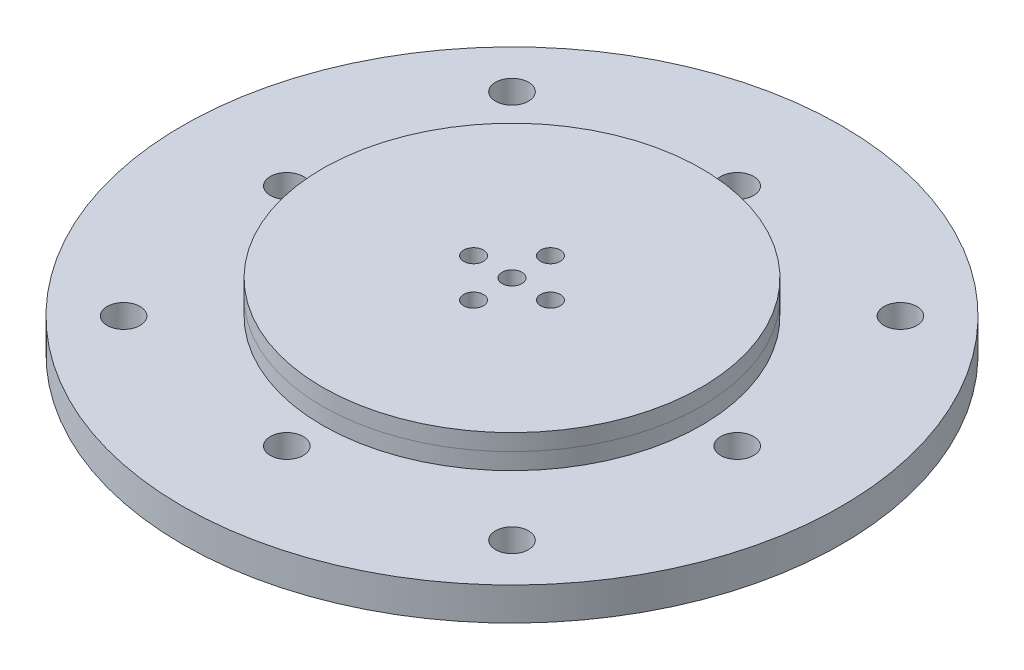
from build123d import *

# Parameters (mm, degrees)
SKETCH1_R                      = 60
BOSS_EXTRUDE1_DEPTH            = 6
SKETCH3_R                      = 34.5
BOSS_EXTRUDE3_DEPTH            = 3
F_6_0_6_DIAMETER_HOLE1_D       = 6
F_6_0_6_DIAMETER_HOLE2_D       = 6
CBORE_FOR_M3_SHCS1_D           = 3.6
CBORE_FOR_M3_SHCS1_CBORE_D     = 6.5
CBORE_FOR_M3_SHCS1_CBORE_DEPTH = 3
MOVE_FACE1_BY                  = 3


with BuildPart() as part:
    # Sketch1 → Boss-Extrude1 (new body)
    with BuildSketch(Plane(origin=(0, 0, 0), x_dir=(1, 0, 0), z_dir=(0, 1, 0))):
        Circle(SKETCH1_R)
    extrude(amount=-BOSS_EXTRUDE1_DEPTH)

    # Sketch3 → Boss-Extrude3 (add)
    with BuildSketch(Plane(origin=(0, 0, 0), x_dir=(1, 0, 0), z_dir=(0, 1, 0))):
        Circle(SKETCH3_R)
    extrude(amount=BOSS_EXTRUDE3_DEPTH)

    # Ø6.0 (6) Diameter Hole1 (through all)
    with Locations(Plane(origin=(0, -6, 0), x_dir=(-1, 0, 0), z_dir=(0, -1, 0))):
        with Locations((0, 41), (0, -41), (41, 0), (-41, 0)):
            Hole(F_6_0_6_DIAMETER_HOLE1_D / 2)

    # Ø6.0 (6) Diameter Hole2 (through all)
    with Locations(Plane(origin=(0, -6, 0), x_dir=(-1, 0, 0), z_dir=(0, -1, 0))):
        with Locations((-35.355339059, 35.355339059), (35.355339059, -35.355339059), (-35.355339059, -35.355339059), (35.355339059, 35.355339059)):
            Hole(F_6_0_6_DIAMETER_HOLE2_D / 2)

    # CBORE for M3 SHCS1 (through all)
    with Locations(Plane(origin=(0, -6, 0), x_dir=(-1, 0, 0), z_dir=(0, -1, 0))):
        with Locations((0, 0), (0, 7), (0, -7), (-7, 0), (7, 0)):
            CounterBoreHole(CBORE_FOR_M3_SHCS1_D / 2, CBORE_FOR_M3_SHCS1_CBORE_D / 2, CBORE_FOR_M3_SHCS1_CBORE_DEPTH)

    # Move Face1: a face moved outward by 3.0
    extrude(part.faces().sort_by_distance((0, 3, 17.25))[0], amount=MOVE_FACE1_BY, dir=(0, 1, 0))


with BuildPart() as body_2:
    # Split1: the piece on the far side of the plane
    add(part.part)
    split(bisect_by=Plane.ZX.offset(3), keep=Keep.BOTTOM)


with BuildPart() as part_1:
    add(part.part)

    # Split1
    split(bisect_by=Plane.ZX.offset(3), keep=Keep.TOP)


solid = Compound([body_2.part, part_1.part])
